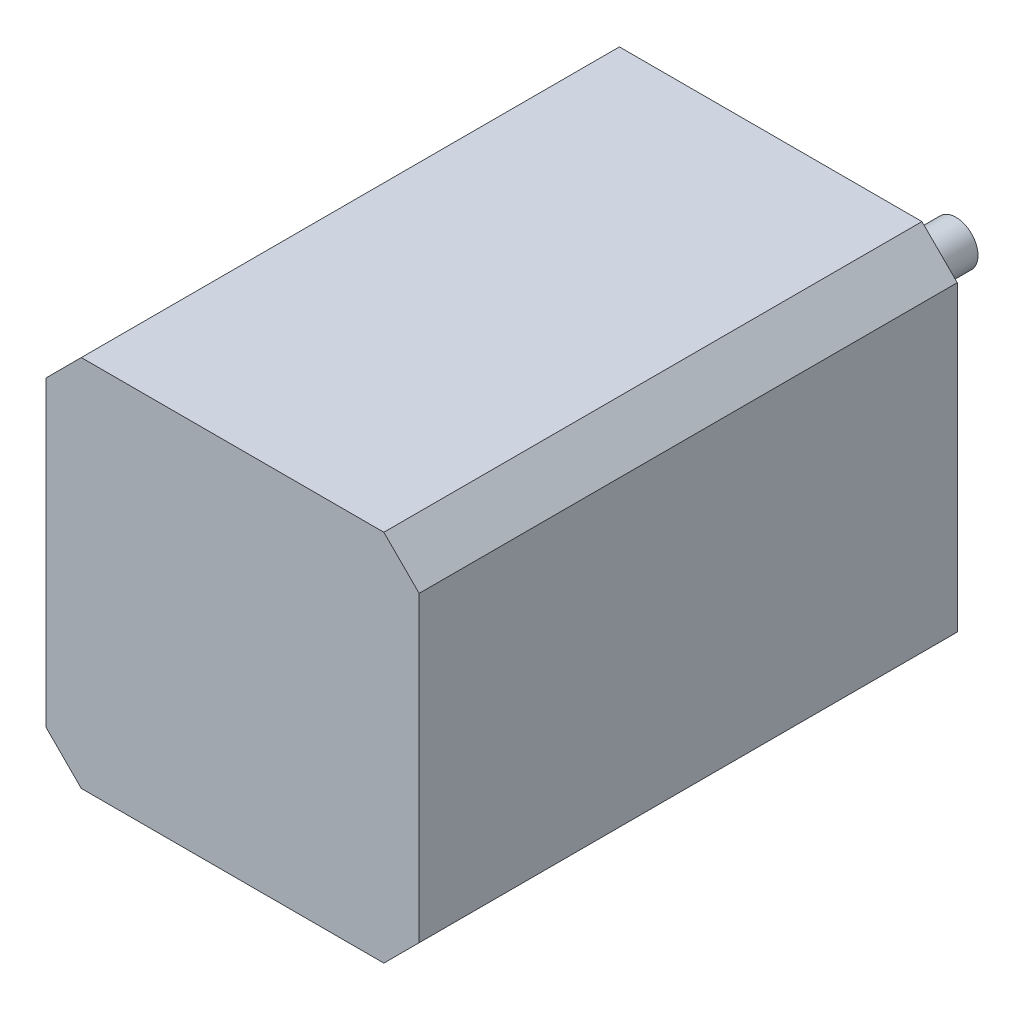
from build123d import *

# Parameters (mm, degrees)
SKETCH1_W           = 42.3
SKETCH1_H           = 42.3
SKETCH1_R           = 2
SKETCH1_R_2         = 11
SKETCH1_R_3         = 2.5
BOSS_EXTRUDE1_DEPTH = 61
SKETCH1_3_R         = 11
SKETCH1_3_R_2       = 2.5
BOSS_EXTRUDE2_DEPTH = 2
SKETCH1_4_R         = 2
CUT_EXTRUDE1_DEPTH  = 2
BOSS_EXTRUDE3_START = -2
SKETCH1_5_R         = 2.5
BOSS_EXTRUDE3_DEPTH = 19
CHAMFER1_SIZE       = 4


with BuildPart() as part:
    # Sketch1 → Boss-Extrude1 (new body)
    # profile 1 of 7: a face of its own
    with BuildSketch(Plane.XY):
        Rectangle(SKETCH1_W, SKETCH1_H)
        with Locations((-12.727922061, -12.727922061)):
            Circle(SKETCH1_R, mode=Mode.SUBTRACT)
        with Locations((12.727922061, -12.727922061)):
            Circle(SKETCH1_R, mode=Mode.SUBTRACT)
        with Locations((12.727922061, 12.727922061)):
            Circle(SKETCH1_R, mode=Mode.SUBTRACT)
        with Locations((-12.727922061, 12.727922061)):
            Circle(SKETCH1_R, mode=Mode.SUBTRACT)
        Circle(SKETCH1_R_2, mode=Mode.SUBTRACT)
    # profile 2 of 7: a face of its own
    with BuildSketch(Plane.XY):
        Circle(SKETCH1_R_2)
        Circle(SKETCH1_R_3, mode=Mode.SUBTRACT)
    # profile 3 of 7: a face of its own
    with BuildSketch(Plane.XY):
        with Locations((-12.727922061, -12.727922061)):
            Circle(SKETCH1_R)
    # profile 4 of 7: a face of its own
    with BuildSketch(Plane.XY):
        with Locations((-12.727922061, 12.727922061)):
            Circle(SKETCH1_R)
    # profile 5 of 7: a face of its own
    with BuildSketch(Plane.XY):
        with Locations((12.727922061, 12.727922061)):
            Circle(SKETCH1_R)
    # profile 6 of 7: a face of its own
    with BuildSketch(Plane.XY):
        with Locations((12.727922061, -12.727922061)):
            Circle(SKETCH1_R)
    # profile 7 of 7: a face of its own
    with BuildSketch(Plane.XY):
        Circle(SKETCH1_R_3)
    extrude(amount=BOSS_EXTRUDE1_DEPTH)

    # Sketch1<3> → Boss-Extrude2 (add)
    with BuildSketch(Plane.XY):
        Circle(SKETCH1_3_R)
        Circle(SKETCH1_3_R_2, mode=Mode.SUBTRACT)
    extrude(amount=-BOSS_EXTRUDE2_DEPTH)

    # Sketch1<4> → Cut-Extrude1 (cut)
    with BuildSketch(Plane.XY):
        with Locations((12.727922061, 12.727922061)):
            Circle(SKETCH1_4_R)
        with Locations((-12.727922061, 12.727922061)):
            Circle(SKETCH1_4_R)
        with Locations((-12.727922061, -12.727922061)):
            Circle(SKETCH1_4_R)
        with Locations((12.727922061, -12.727922061)):
            Circle(SKETCH1_4_R)
    extrude(amount=CUT_EXTRUDE1_DEPTH, mode=Mode.SUBTRACT)

    # Chamfer1
    chamfer1_edges = [part.edges().sort_by_distance(p)[0] for p in [
        (21.15, -21.15, 30.5),
        (-21.15, -21.15, 30.5),
        (-21.15, 21.15, 30.5),
        (21.15, 21.15, 30.5),
    ]]
    chamfer(chamfer1_edges, length=CHAMFER1_SIZE)


with BuildPart() as body_2:
    # Sketch1<5> → Boss-Extrude3 (new body)
    with BuildSketch(Plane.XY.offset(BOSS_EXTRUDE3_START)):
        Circle(SKETCH1_5_R)
    extrude(amount=-BOSS_EXTRUDE3_DEPTH)


solid = Compound([part.part, body_2.part])
